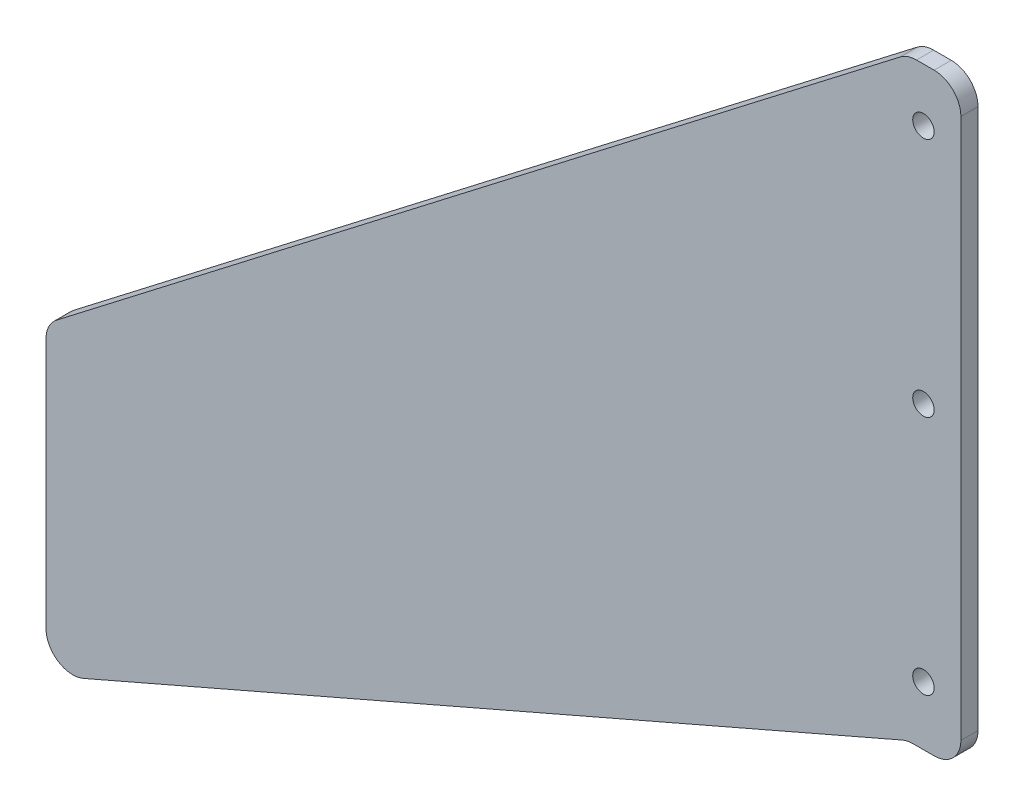
from build123d import *

# Parameters (mm, degrees)
EXTRUDE_1_DEPTH      = 1.6
EXTRUDE_1_DEPTH_BACK = 1.6


with BuildPart() as part:
    # Эскиз1 → Бобышка-Вытянуть1 (new, two sides: drawn at the far end of the back side and taken through both)
    with BuildSketch(Plane.XY.offset(-EXTRUDE_1_DEPTH_BACK)):
        with BuildLine():
            Line((-4.348647769, 8.961289917), (-162.050931365, -112.49885397))
            ThreePointArc((-162.050931365, -112.49885397), (-163.486349118, -114.252731015), (-164, -116.460143887))
            Line((-164, -116.460143887), (-164, -163.373940781))
            ThreePointArc((-164, -163.373940781), (-161.741518486, -167.555337245), (-157.006369443, -167.959291062))
            Line((-157.006369443, -167.959291062), (-3.953694353, -101.414649719))
            ThreePointArc((-3.953694353, -101.414649719), (-2.978211279, -101.104759893), (-1.960063796, -101))
            Line((-1.960063796, -101), (2, -101))
            ThreePointArc((2, -101), (3.586523282, -100.741618276), (5.009075116, -99.99317755))
            ThreePointArc((5.009075116, -99.99317755), (6.474671808, -98.230989066), (7, -96))
            Line((7, -96), (7, 5))
            ThreePointArc((7, 5), (5.535533906, 8.535533906), (2, 10))
            Line((2, 10), (-1.297716404, 10))
            ThreePointArc((-1.297716404, 10), (-2.909167678, 9.733204495), (-4.348647769, 8.961289917))
        make_face()
        with BuildLine():
            ThreePointArc((1.203630046, -1.59727102), (1.59727102, 1.203630046), (-1.203630046, 1.59727102))
            ThreePointArc((-1.203630046, 1.59727102), (-1.59727102, -1.203630046), (1.203630046, -1.59727102))
        make_face(mode=Mode.SUBTRACT)
        with BuildLine():
            ThreePointArc((1.203630046, -46.59727102), (1.59727102, -43.796369954), (-1.203630046, -43.40272898))
            ThreePointArc((-1.203630046, -43.40272898), (-1.59727102, -46.203630046), (1.203630046, -46.59727102))
        make_face(mode=Mode.SUBTRACT)
        with BuildLine():
            ThreePointArc((1.203630046, -91.59727102), (1.59727102, -88.796369954), (-1.203630046, -88.40272898))
            ThreePointArc((-1.203630046, -88.40272898), (-1.59727102, -91.203630046), (1.203630046, -91.59727102))
        make_face(mode=Mode.SUBTRACT)
    extrude(amount=EXTRUDE_1_DEPTH + EXTRUDE_1_DEPTH_BACK)


solid = part.part
